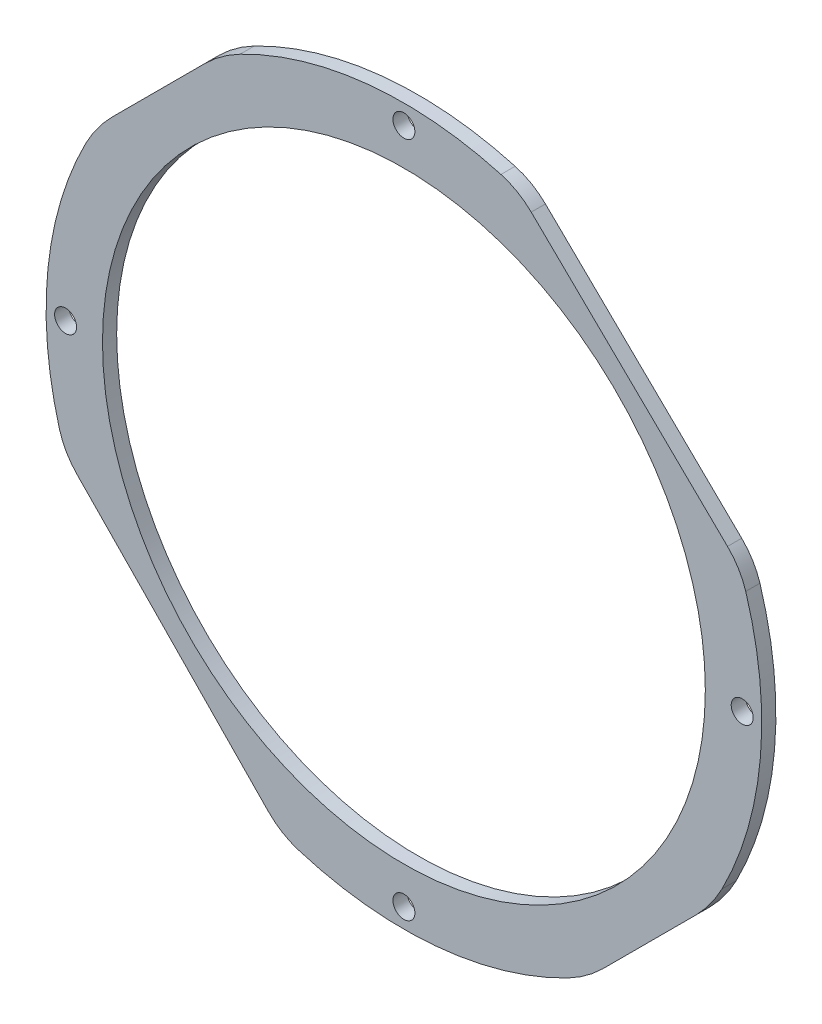
from build123d import *

# Parameters (mm, degrees)
SKETCH_1_R          = 50.45
SKETCH_1_R_2        = 1.55
SKETCH_1_R_3        = 42.5
EXTRUDE_1_DEPTH     = 2
CUT_EXTRUDE_START   = -8
CUT_EXTRUDE_1_DEPTH = 8
FILLET_1_R          = 20
CUT_EXTRUDE_2_DEPTH = 10
CUT_EXTRUDE_3_DEPTH = 10
FILLET_2_R          = 10


with BuildPart() as part:
    # 草图1 → 凸台-拉伸1 (new body)
    with BuildSketch(Plane.XY):
        Circle(SKETCH_1_R)
        with Locations((0, 47.7)):
            Circle(SKETCH_1_R_2, mode=Mode.SUBTRACT)
        with Locations((47.7, 0)):
            Circle(SKETCH_1_R_2, mode=Mode.SUBTRACT)
        with Locations((0, -47.7)):
            Circle(SKETCH_1_R_2, mode=Mode.SUBTRACT)
        with Locations((-47.7, 0)):
            Circle(SKETCH_1_R_2, mode=Mode.SUBTRACT)
        Circle(SKETCH_1_R_3, mode=Mode.SUBTRACT)
    extrude(amount=EXTRUDE_1_DEPTH)

    # 草图2 → 切除-拉伸1 (cut)
    with BuildSketch(Plane.XY.offset(2).offset(CUT_EXTRUDE_START)):
        with BuildLine():
            Line((-26.156986786, 43.13947777), (-43.13947777, 26.156986786))
            ThreePointArc((-43.13947777, 26.156986786), (-35.673537111, 35.673537111), (-26.156986786, 43.13947777))
        make_face()
        with BuildLine():
            Line((43.13947777, 26.156986786), (26.156986786, 43.13947777))
            ThreePointArc((26.156986786, 43.13947777), (35.673537111, 35.673537111), (43.13947777, 26.156986786))
        make_face()
        with BuildLine():
            Line((26.156986786, -43.13947777), (43.13947777, -26.156986786))
            ThreePointArc((43.13947777, -26.156986786), (35.673537111, -35.673537111), (26.156986786, -43.13947777))
        make_face()
        with BuildLine():
            Line((-43.13947777, -26.156986786), (-26.156986786, -43.13947777))
            ThreePointArc((-26.156986786, -43.13947777), (-35.673537111, -35.673537111), (-43.13947777, -26.156986786))
        make_face()
    extrude(amount=CUT_EXTRUDE_1_DEPTH, mode=Mode.SUBTRACT)

    # 圆角1
    fillet_1_edges = [part.edges().sort_by_distance(p)[0] for p in [
        (-26.156986786, 43.13947777, 1),
        (-43.13947777, 26.156986786, 1),
        (43.13947777, 26.156986786, 1),
        (26.156986786, 43.13947777, 1),
        (26.156986786, -43.13947777, 1),
        (43.13947777, -26.156986786, 1),
        (-43.13947777, -26.156986786, 1),
        (-26.156986786, -43.13947777, 1),
    ]]
    fillet(fillet_1_edges, radius=FILLET_1_R)

    # 草图4 → 切除-拉伸2 (cut)
    with BuildSketch(Plane.XY.offset(2)):
        Polygon((-18.704164587, -51.054840678), (-51.986667617, -16.922686111), (-49.480801159, -14.479198174), (-16.19829813, -48.611352741), align=None)
        Polygon((48.611352741, 16.19829813), (51.054840678, 18.704164587), (16.922686111, 51.986667617), (14.479198174, 49.480801159), align=None)
    extrude(amount=-CUT_EXTRUDE_2_DEPTH, mode=Mode.SUBTRACT)


with BuildPart() as cut_extrude_2_piece_1:
    # of the separate pieces the step leaves, piece 1, a body of its own (cut_extrude_2_pieces)
    add(part.part.solids().sort_by_distance((44.852039635, -23.097554862, 0))[0])

    # 圆角2
    fillet_2_edges = [cut_extrude_2_piece_1.edges().sort_by_distance(p)[0] for p in [
        (-17.437312859, -47.340707855, 1),
        (47.340707855, 17.437312859, 1),
        (16.238659163, 47.765138423, 1),
        (-47.765138423, -16.238659163, 1),
    ]]
    fillet(fillet_2_edges, radius=FILLET_2_R)


with BuildPart() as cut_extrude_2_piece_2:
    # of the separate pieces the step leaves, piece 2, a body of its own (cut_extrude_2_pieces)
    add(part.part.solids().sort_by_distance((-36.822783654, -32.473680902, 0))[0])


with BuildPart() as cut_extrude_2_piece_3:
    # of the separate pieces the step leaves, piece 3, a body of its own (cut_extrude_2_pieces)
    add(part.part.solids().sort_by_distance((32.473680902, 36.822783654, 0))[0])


with BuildPart() as cut_extrude_3_tool:
    # 草图5 → 切除-拉伸3 (new body)
    with BuildSketch(Plane.XY.offset(2)):
        with BuildLine():
            Line((-36.822783654, -32.473680902), (-42.579696276, -26.569803082))
            ThreePointArc((-42.579696276, -26.569803082), (-41.915837064, -27.343862298), (-41.213386503, -28.083078053))
            Line((-41.213386503, -28.083078053), (-36.822783654, -32.473680902))
        make_face()
        with BuildLine():
            Line((26.569803082, 42.579696276), (32.473680902, 36.822783654))
            Line((32.473680902, 36.822783654), (28.083078053, 41.213386503))
            ThreePointArc((28.083078053, 41.213386503), (27.343862298, 41.915837064), (26.569803082, 42.579696276))
        make_face()
    extrude(amount=-CUT_EXTRUDE_3_DEPTH)


with BuildPart() as cut_extrude_2_piece_2_1:
    add(cut_extrude_2_piece_2.part)

    # 切除-拉伸3: cut by cut_extrude_3_tool
    add(cut_extrude_3_tool.part, mode=Mode.SUBTRACT)


with BuildPart() as cut_extrude_2_piece_3_1:
    add(cut_extrude_2_piece_3.part)

    # 切除-拉伸3: cut by cut_extrude_3_tool
    add(cut_extrude_3_tool.part, mode=Mode.SUBTRACT)


solid = cut_extrude_2_piece_1.part
